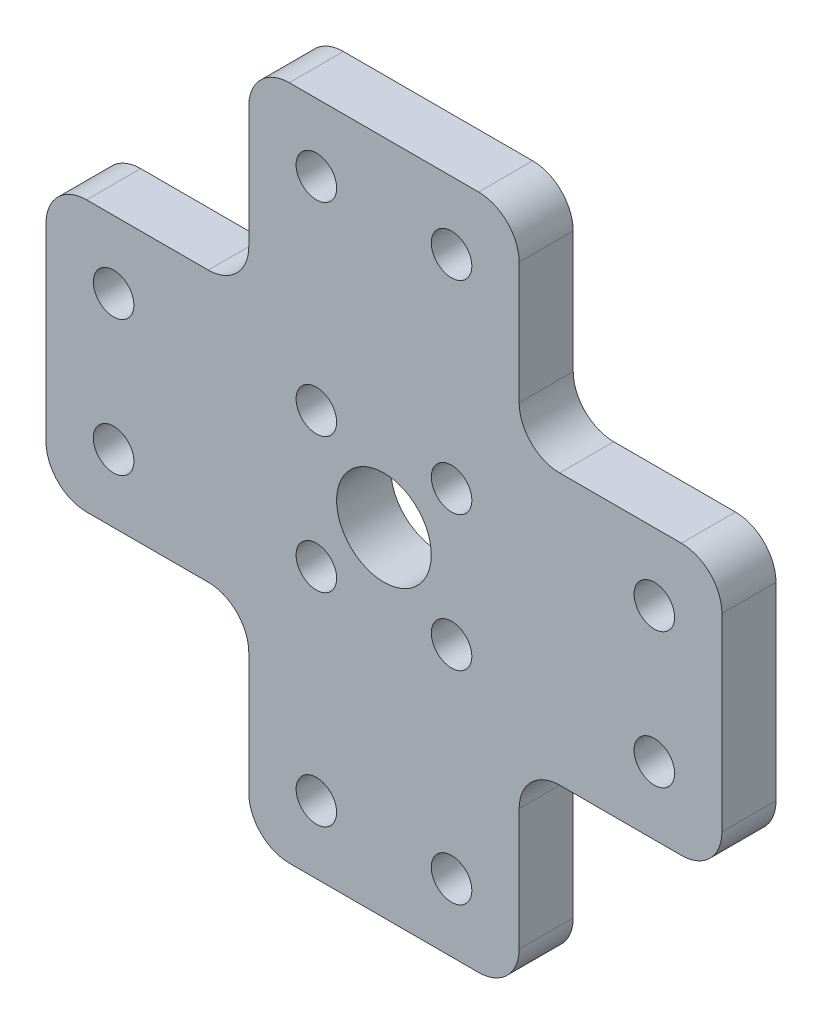
from build123d import *

# Parameters (mm, degrees)
SKETCH_1_R      = 1.5
SKETCH_1_R_2    = 3.5
EXTRUDE_1_DEPTH = 4
FILLET_1_R      = 3


with BuildPart() as part:
    # 草图1 → 凸台-拉伸1 (new body)
    with BuildSketch(Plane.XY):
        Polygon((-10, 10), (-25, 10), (-25, -10), (-10, -10), (-10, -25), (10, -25), (10, -10), (25, -10), (25, 10), (10, 10), (10, 25), (-10, 25), align=None)
        with Locations((-20, -5)):
            Circle(SKETCH_1_R, mode=Mode.SUBTRACT)
        with Locations((-20, 5)):
            Circle(SKETCH_1_R, mode=Mode.SUBTRACT)
        with Locations((5, 5)):
            Circle(SKETCH_1_R, mode=Mode.SUBTRACT)
        with Locations((-5, -5)):
            Circle(SKETCH_1_R, mode=Mode.SUBTRACT)
        with Locations((5, -5)):
            Circle(SKETCH_1_R, mode=Mode.SUBTRACT)
        Circle(SKETCH_1_R_2, mode=Mode.SUBTRACT)
        with Locations((-5, 5)):
            Circle(SKETCH_1_R, mode=Mode.SUBTRACT)
        with Locations((5, 20)):
            Circle(SKETCH_1_R, mode=Mode.SUBTRACT)
        with Locations((-5, 20)):
            Circle(SKETCH_1_R, mode=Mode.SUBTRACT)
        with Locations((20, 5)):
            Circle(SKETCH_1_R, mode=Mode.SUBTRACT)
        with Locations((20, -5)):
            Circle(SKETCH_1_R, mode=Mode.SUBTRACT)
        with Locations((5, -20)):
            Circle(SKETCH_1_R, mode=Mode.SUBTRACT)
        with Locations((-5, -20)):
            Circle(SKETCH_1_R, mode=Mode.SUBTRACT)
    extrude(amount=EXTRUDE_1_DEPTH)

    # 圆角1
    fillet_1_edges = [part.edges().sort_by_distance(p)[0] for p in [
        (25, 10, 2),
        (25, -10, 2),
        (10, -10, 2),
        (10, -25, 2),
        (-10, -25, 2),
        (-10, -10, 2),
        (-25, -10, 2),
        (-25, 10, 2),
        (-10, 10, 2),
        (-10, 25, 2),
        (10, 25, 2),
        (10, 10, 2),
    ]]
    fillet(fillet_1_edges, radius=FILLET_1_R)


solid = part.part
